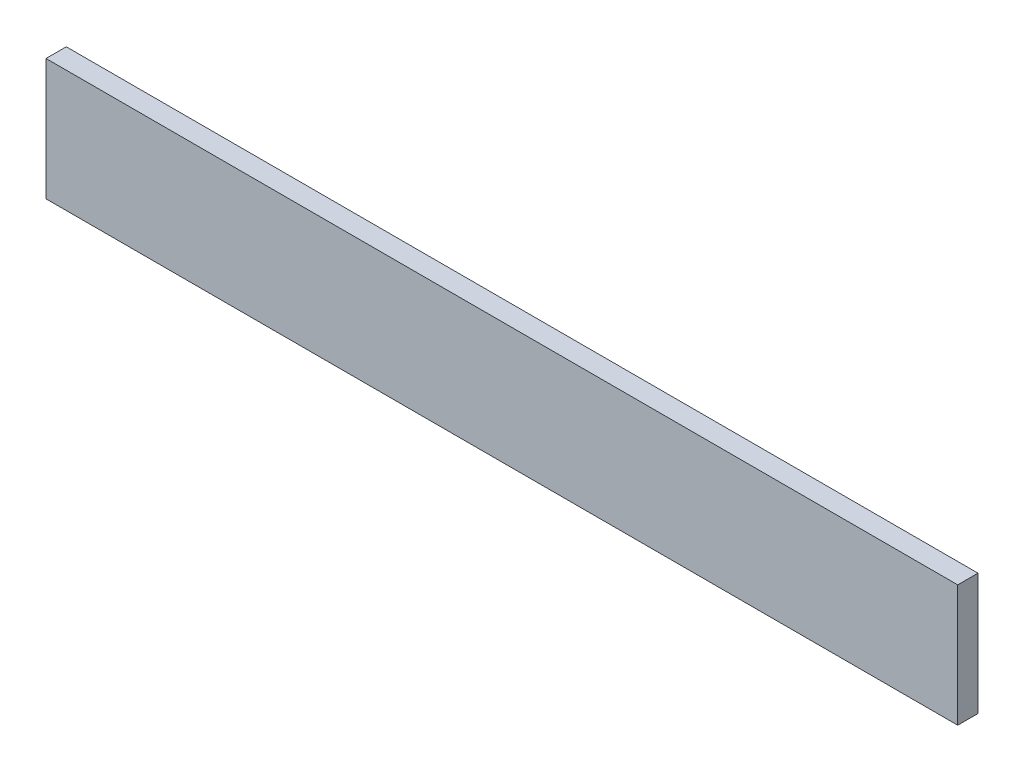
from build123d import *

# Parameters (mm, degrees)
ESBO_O1_W                = 270
ESBO_O1_H                = 36
RESSALTO_EXTRUS_O1_DEPTH = 6


with BuildPart() as part:
    # Esboço1 → Ressalto-extrusão1 (new body)
    with BuildSketch(Plane.XY):
        with Locations((-135, 18)):
            Rectangle(ESBO_O1_W, ESBO_O1_H)
    extrude(amount=RESSALTO_EXTRUS_O1_DEPTH)


solid = part.part
